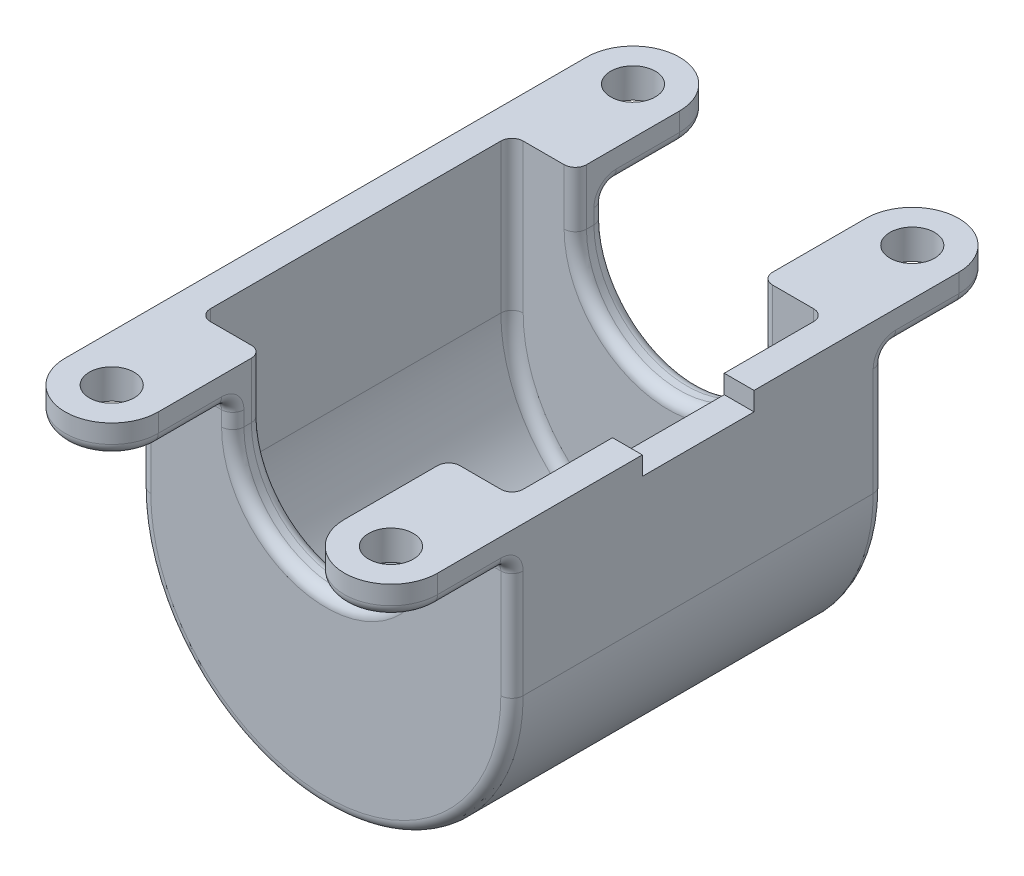
from build123d import *

# Parameters (mm, degrees)
BOSS_EXTRUDE1_DEPTH        = 50
SHELL1_T                   = -8
BOSS_EXTRUDE2_DEPTH        = 8
F_12_0_12_DIAMETER_HOLE1_D = 12
MIRROR2_COPY_1_DEPTH       = 8
MIRROR2_COPY_2_D           = 12
SKETCH6_W                  = 30
SKETCH6_H                  = 10
CUT_EXTRUDE1_DEPTH         = 123.193494098
FILLET1_R                  = 3
FILLET2_R                  = 3


with BuildPart() as part:
    # Sketch1 → Boss-Extrude1 (new, symmetric)
    with BuildSketch(Plane.XY):
        with BuildLine():
            Line((-25, 15), (-25, 0))
            ThreePointArc((-25, 0), (0, -25), (25, 0))
            Line((25, 0), (25, 15))
            Line((25, 15), (50, 15))
            Line((50, 15), (50, -25))
            ThreePointArc((50, -25), (0, -75), (-50, -25))
            Line((-50, -25), (-50, 15))
            Line((-50, 15), (-25, 15))
        make_face()
    extrude(amount=BOSS_EXTRUDE1_DEPTH, both=True)

    # Shell1
    shell1_openings = [part.faces().sort_by_distance(p)[0] for p in [
        (-25, 7.5, 0),
        (0, -25, 0),
        (25, 7.5, 0),
        (37.5, 15, 0),
        (-37.5, 15, 0),
    ]]
    offset(amount=SHELL1_T, openings=shell1_openings, kind=Kind.INTERSECTION)

    # Sketch2 → Boss-Extrude2 (add)
    with BuildSketch(Plane(origin=(0, 15, 0), x_dir=(1, 0, 0), z_dir=(0, 1, 0))):
        with BuildLine():
            Line((-50, -50), (-25, -50))
            Line((-25, -50), (-25, -70))
            ThreePointArc((-25, -70), (-37.5, -82.5), (-50, -70))
            Line((-50, -70), (-50, -50))
        make_face()
    boss_extrude2 = extrude(amount=-BOSS_EXTRUDE2_DEPTH)

    # Ø12.0 (12) Diameter Hole1 (through all)
    with Locations(Plane(origin=(0, 15, 0), x_dir=(1, 0, 0), z_dir=(0, 1, 0))):
        with Locations((-37.5, -70)):
            f_12_0_12_diameter_hole1 = Hole(F_12_0_12_DIAMETER_HOLE1_D / 2)

    # Mirror1: Boss-Extrude2, Ø12.0 (12) Diameter Hole1 across plane
    add(boss_extrude2.mirror(Plane(origin=(0, 0, 0), x_dir=(0, 0, 1), z_dir=(1, 0, 0))))
    add(f_12_0_12_diameter_hole1.mirror(Plane(origin=(0, 0, 0), x_dir=(0, 0, 1), z_dir=(1, 0, 0))), mode=Mode.SUBTRACT)

    # Mirror2: Boss-Extrude2, Ø12.0 (12) Diameter Hole1 across plane
    add(boss_extrude2.mirror(Plane.XY))
    add(f_12_0_12_diameter_hole1.mirror(Plane.XY), mode=Mode.SUBTRACT)

    # Mirror2 copy 1 sketch → Mirror2 copy 1 (add)
    with BuildSketch(Plane(origin=(0, 15, 0), x_dir=(-1, 0, 0), z_dir=(0, 1, 0))):
        with BuildLine():
            Line((-50, -50), (-25, -50))
            Line((-25, -50), (-25, -70))
            ThreePointArc((-25, -70), (-37.5, -82.5), (-50, -70))
            Line((-50, -70), (-50, -50))
        make_face()
    extrude(amount=-MIRROR2_COPY_1_DEPTH)

    # Mirror2 copy 2 (through all)
    with Locations(Plane(origin=(0, 15, 0), x_dir=(-1, 0, 0), z_dir=(0, 1, 0))):
        with Locations((-37.5, -70)):
            Hole(MIRROR2_COPY_2_D / 2)

    # Sketch6 → Cut-Extrude1 (cut, through all)
    with BuildSketch(Plane(origin=(0, 0, 0), x_dir=(0, 0, -1), z_dir=(1, 0, 0))):
        with Locations((0, 15)):
            Rectangle(SKETCH6_W, SKETCH6_H)
    extrude(amount=CUT_EXTRUDE1_DEPTH, mode=Mode.SUBTRACT)

    # Fillet1
    fillet1_edges = [part.edges().sort_by_distance(p)[0] for p in [
        (-37.5, 7, -50),
        (37.5, 7, -50),
        (37.5, 7, 50),
        (-37.5, 7, 50),
    ]]
    fillet(fillet1_edges, radius=FILLET1_R)

    # Fillet2
    fillet2_edges = [part.edges().sort_by_distance(p)[0] for p in [
        (0, -75, 50),
        (-37.5, 7, -82.5),
        (-25, 7, -61.5),
        (50, -10.5, 50),
        (-50, 7, -61.5),
        (25, 2, -50),
        (-50, -10.5, -50),
        (50, 7, -61.5),
        (50, 7, 61.5),
        (25, 2, 50),
        (-50, -10.5, 50),
        (-50, 7, 61.5),
        (-50, 6.121320344, -50.878679656),
        (-25, 6.121320344, -50.878679656),
        (50, 6.121320344, -50.878679656),
        (25, 6.121320344, -50.878679656),
        (50, 6.121320344, 50.878679656),
        (25, 6.121320344, 50.878679656),
        (-50, 6.121320344, 50.878679656),
        (-25, 6.121320344, 50.878679656),
        (0, -25, 50),
        (-25, 2, 50),
        (-42, -5, -42),
        (0, -67, -42),
        (42, -5, -42),
        (25, 7.5, -42),
        (0, -25, -42),
        (-25, 7.5, -42),
        (-42, -5, 42),
        (0, -67, 42),
        (42, -5, 42),
        (25, 7.5, 42),
        (0, -25, 42),
        (-25, 7.5, 42),
        (-25, 7, 61.5),
        (-37.5, 7, 82.5),
        (37.5, 7, 82.5),
        (25, 7, 61.5),
        (-25, 2, -50),
        (0, -25, -50),
        (25, 7, -61.5),
        (37.5, 7, -82.5),
        (50, -10.5, -50),
        (0, -75, -50),
    ]]
    fillet(fillet2_edges, radius=FILLET2_R)


solid = part.part
